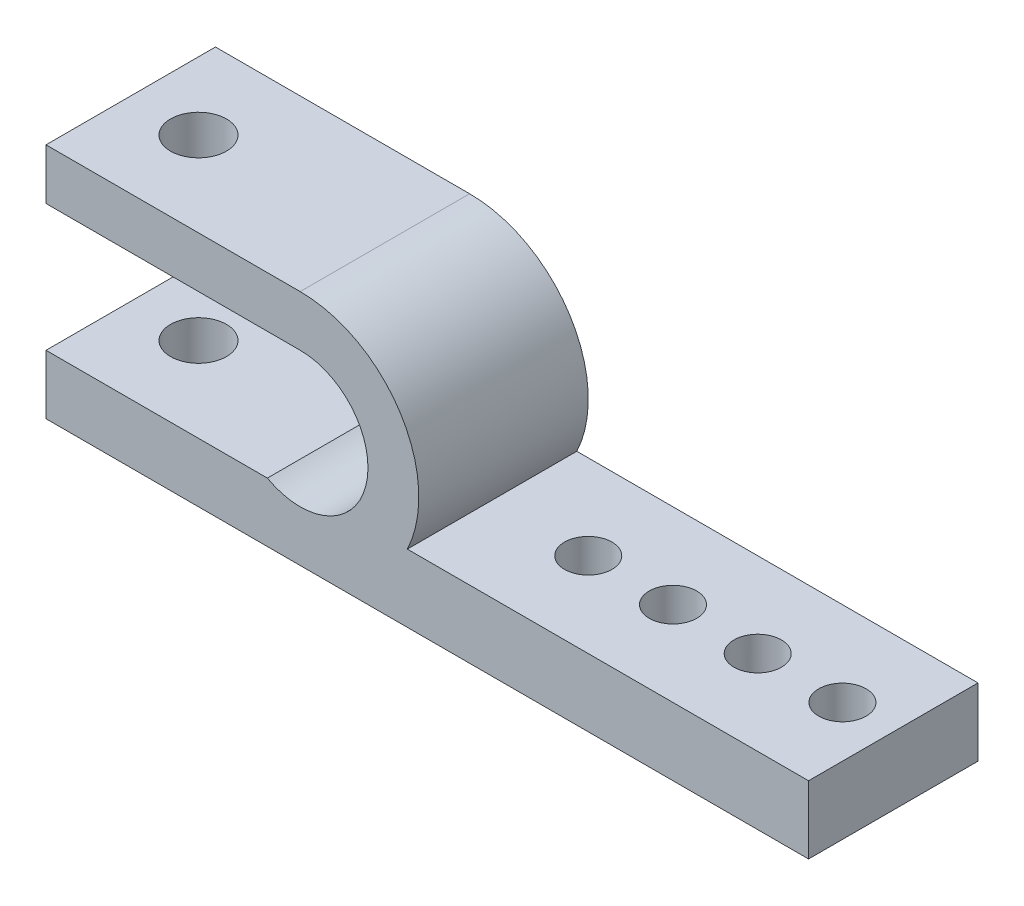
from build123d import *

# Parameters (mm, degrees)
BOSS_EXTRUDE1_DEPTH     = 10
SKETCH2_R               = 1.65
CUT_EXTRUDE1_DEPTH      = 26.395491135
BOSS_EXTRUDE2_START     = -10
BOSS_EXTRUDE2_DEPTH     = 10
CUT_EXTRUDE3_DEPTH      = 10
CUT_EXTRUDE3_DEPTH_BACK = 10
SKETCH8_R               = 1.4
SKETCH9_R               = 1.65
CUT_EXTRUDE4_DEPTH      = 46.090984648


with BuildPart() as part:
    # Sketch1 → Boss-Extrude1 (new body)
    with BuildSketch(Plane.XY):
        with BuildLine():
            Line((11.679694055, 24.106798453), (-3.320305945, 24.106798453))
            Line((-3.320305945, 24.106798453), (-3.320305945, 27.106798453))
            Line((-3.320305945, 27.106798453), (11.679694055, 27.106798453))
            ThreePointArc((11.679694055, 27.106798453), (18.679694055, 20.106798453), (11.679694055, 13.106798453))
            Line((11.679694055, 13.106798453), (-3.320305945, 13.106798453))
            Line((-3.320305945, 13.106798453), (-3.320305945, 16.606798453))
            Line((-3.320305945, 16.606798453), (9.743202382, 16.606798453))
            ThreePointArc((9.743202382, 16.606798453), (15.552677401, 19.106798453), (11.679694055, 24.106798453))
        make_face()
    extrude(amount=BOSS_EXTRUDE1_DEPTH)

    # Sketch2 → Cut-Extrude1 (cut, through all)
    with BuildSketch(Plane(origin=(0, 27.106798453, 0), x_dir=(1, 0, 0), z_dir=(0, 1, 0))):
        with Locations(Location((0.679694055, -5, 0), (0, 0, 180))):
            Circle(SKETCH2_R)
    extrude(amount=-CUT_EXTRUDE1_DEPTH, mode=Mode.SUBTRACT)

    # Sketch5 → Boss-Extrude2 (add)
    with BuildSketch(Plane.XY.offset(10).offset(BOSS_EXTRUDE2_START)):
        with BuildLine():
            Line((41.679694055, 17.106798453), (14.325445366, 17.106798453))
            ThreePointArc((14.325445366, 17.106798453), (12.113586102, 16.130400875), (9.743202382, 16.606798453))
            Line((9.743202382, 16.606798453), (-3.320305945, 16.606798453))
            Line((-3.320305945, 16.606798453), (-3.320305945, 13.106798453))
            Line((-3.320305945, 13.106798453), (41.679694055, 13.106798453))
            Line((41.679694055, 13.106798453), (41.679694055, 17.106798453))
        make_face()
    extrude(amount=BOSS_EXTRUDE2_DEPTH)

    # Sketch8 → Cut-Extrude3 (cut, two sides: drawn at the far end of the back side and taken through both)
    with BuildSketch(Plane(origin=(0, 13.948922433, 0), x_dir=(1, 0, 0), z_dir=(0, 1, 0)).offset(-CUT_EXTRUDE3_DEPTH_BACK)):
        with Locations((28.679694055, -5)):
            Circle(SKETCH8_R)
        with Locations((38.679694055, -5)):
            Circle(SKETCH8_R)
        with Locations((23.679694055, -5)):
            Circle(SKETCH8_R)
        with Locations((33.679694055, -5)):
            Circle(SKETCH8_R)
    extrude(amount=CUT_EXTRUDE3_DEPTH + CUT_EXTRUDE3_DEPTH_BACK, mode=Mode.SUBTRACT)

    # Sketch9 → Cut-Extrude4 (cut, through all)
    with BuildSketch(Plane(origin=(0, 27.106798453, 0), x_dir=(1, 0, 0), z_dir=(0, 1, 0))):
        with Locations(Location((0.679694055, -5, 0), (0, 0, 180))):
            Circle(SKETCH9_R)
    extrude(amount=-CUT_EXTRUDE4_DEPTH, mode=Mode.SUBTRACT)


solid = part.part
